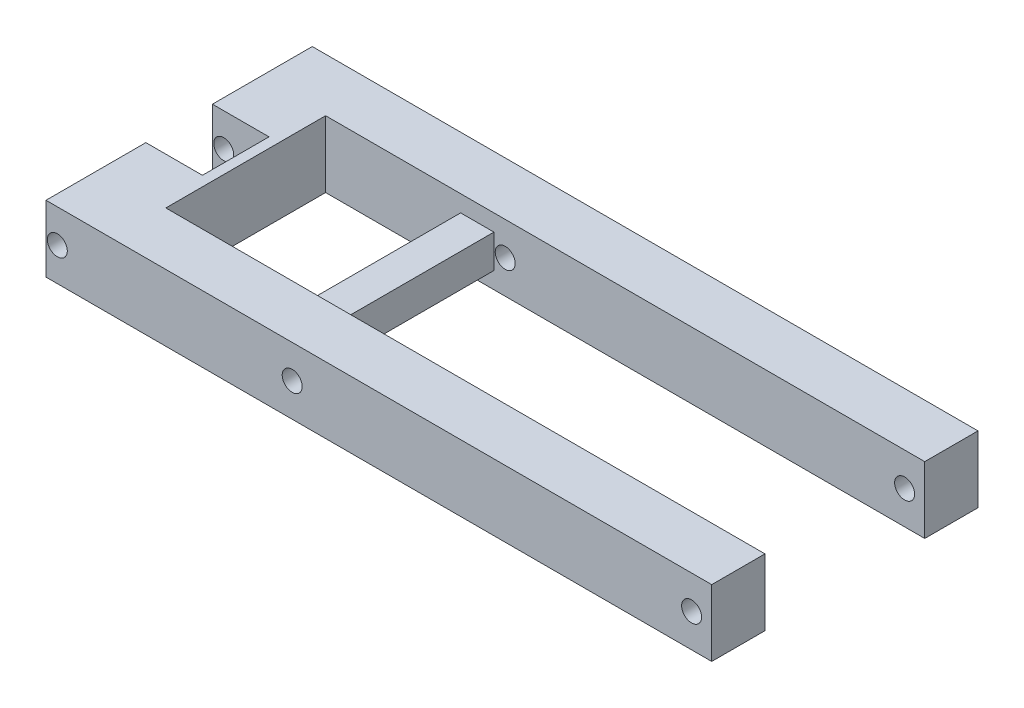
from build123d import *

# Parameters (mm, degrees)
ESTRUSIONE_ESTRUSIONE1_DEPTH             = 100
TAGLIO_ESTRUSIONE5_DEPTH                 = 704.628710974
TAGLIO_ESTRUSIONE5_DEPTH_BACK            = 704.628710974
SCHIZZO2_R                               = 15
TAGLIO_ESTRUSIONE6_DEPTH                 = 704.628710974
TAGLIO_ESTRUSIONE6_DEPTH_BACK            = 704.628710974
SCHIZZO3_W                               = 85
SCHIZZO3_H                               = 100
ESTRUSIONE_ESTRUSIONE2_REACH             = 705.629
SCHIZZO4_W                               = 50
SCHIZZO4_H                               = 50
ESTRUSIONE_ESTRUSIONE2_DIRECTION_2_REACH = 705.629


with BuildPart() as part:
    # Schizzo1 → Estrusione-Estrusione1 (new body)
    with BuildSketch(Plane(origin=(0, 0, 0), x_dir=(1, 0, 0), z_dir=(0, 1, 0))):
        Polygon((-332.846822006, -200), (-332.846822006, 200), (667.153177994, 200), (667.153177994, 120), (-232.846822006, 120), (-232.846822006, -120), (667.153177994, -120), (667.153177994, -200), align=None)
    extrude(amount=ESTRUSIONE_ESTRUSIONE1_DEPTH)

    # Schizzo2 → Taglio-Estrusione5 (cut, two sides: drawn at the far end of the back side and taken through both)
    with BuildSketch(Plane.XY.offset(-TAGLIO_ESTRUSIONE5_DEPTH_BACK)):
        with Locations((-315.846822006, 50)):
            Circle(SCHIZZO2_R)
        with Locations((36.953177994, 50)):
            Circle(SCHIZZO2_R)
        with Locations((636.953177994, 50)):
            Circle(SCHIZZO2_R)
    extrude(amount=TAGLIO_ESTRUSIONE5_DEPTH + TAGLIO_ESTRUSIONE5_DEPTH_BACK, mode=Mode.SUBTRACT)

    # Schizzo3 → Taglio-Estrusione6 (cut, two sides: drawn at the far end of the back side and taken through both)
    with BuildSketch(Plane(origin=(0, 0, 0), x_dir=(1, 0, 0), z_dir=(0, 1, 0)).offset(-TAGLIO_ESTRUSIONE6_DEPTH_BACK)):
        with Locations((-290.346822006, 0)):
            Rectangle(SCHIZZO3_W, SCHIZZO3_H)
    extrude(amount=TAGLIO_ESTRUSIONE6_DEPTH + TAGLIO_ESTRUSIONE6_DEPTH_BACK, mode=Mode.SUBTRACT)

    # Schizzo4 → Estrusione-Estrusione2 (add, up to next)
    with BuildSketch(Plane.XY, mode=Mode.PRIVATE) as estrusione_estrusione2_sk1:
        with Locations((-5, 50)):
            Rectangle(SCHIZZO4_W, SCHIZZO4_H)
    estrusione_estrusione2_tool1 = extrude(estrusione_estrusione2_sk1.sketch, amount=ESTRUSIONE_ESTRUSIONE2_REACH, mode=Mode.PRIVATE) - part.part
    add(estrusione_estrusione2_tool1.solids().sort_by_distance((-5, 50, 0))[0])

    # Schizzo4 → Estrusione-Estrusione2 direction 2 (add, up to next)
    with BuildSketch(Plane.XY, mode=Mode.PRIVATE) as estrusione_estrusione2_direction_2_sk1:
        with Locations((-5, 50)):
            Rectangle(SCHIZZO4_W, SCHIZZO4_H)
    estrusione_estrusione2_direction_2_tool1 = extrude(estrusione_estrusione2_direction_2_sk1.sketch, amount=-ESTRUSIONE_ESTRUSIONE2_DIRECTION_2_REACH, mode=Mode.PRIVATE) - part.part
    add(estrusione_estrusione2_direction_2_tool1.solids().sort_by_distance((-5, 50, 0))[0])


solid = part.part
